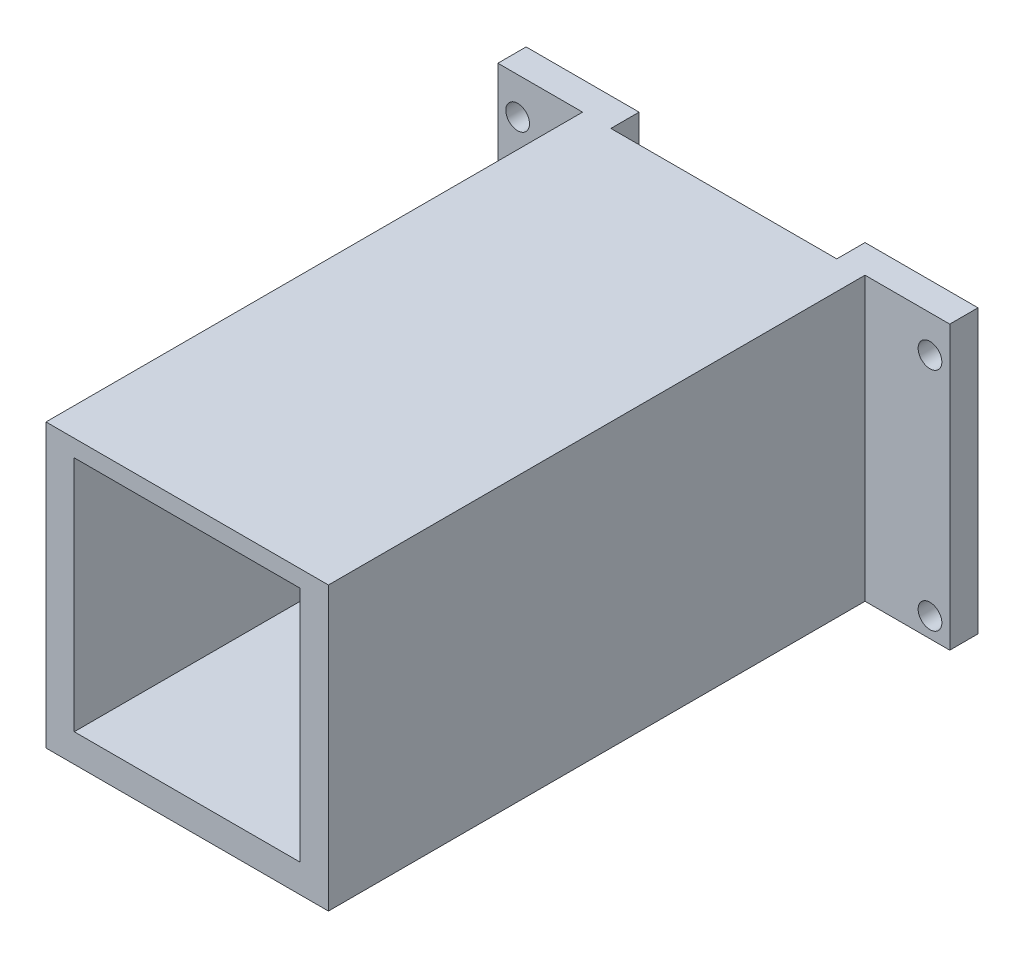
from build123d import *

# Parameters (mm, degrees)
SKETCH_1_W          = 80
SKETCH_1_H          = 50
EXTRUDE_1_DEPTH     = 5
SKETCH_2_W          = 50
SKETCH_2_H          = 50
EXTRUDE_2_DEPTH     = 100
SKETCH_4_W          = 40
SKETCH_4_H          = 42
CUT_EXTRUDE_1_DEPTH = 138.477270849
SKETCH_5_R          = 2.1
CUT_EXTRUDE_2_DEPTH = 10
CUT_EXTRUDE_START   = 40
SKETCH_7_W          = 40
SKETCH_7_H          = 5
CUT_EXTRUDE_4_DEPTH = 98.477270849


with BuildPart() as part:
    # 草圖1 → 填料-伸長1 (new body)
    with BuildSketch(Plane.XY):
        with Locations((40, 25)):
            Rectangle(SKETCH_1_W, SKETCH_1_H)
    extrude(amount=EXTRUDE_1_DEPTH)

    # 草圖2 → 填料-伸長2 (add)
    with BuildSketch(Plane.XY):
        with Locations((40, 25)):
            Rectangle(SKETCH_2_W, SKETCH_2_H)
    extrude(amount=EXTRUDE_2_DEPTH)

    # 草圖4 → 除料-伸長1 (cut, through all)
    with BuildSketch(Plane.XY):
        with Locations((40, 26)):
            Rectangle(SKETCH_4_W, SKETCH_4_H)
    extrude(amount=CUT_EXTRUDE_1_DEPTH, mode=Mode.SUBTRACT)

    # 草圖5 → 除料-伸長2 (cut)
    with BuildSketch(Plane.XY):
        with Locations(Location((76.5, 3.5, 0), (0, 0, 180))):
            Circle(SKETCH_5_R)
        with Locations(Location((76.5, 43.5, 0), (0, 0, 180))):
            Circle(SKETCH_5_R)
        with Locations(Location((3.5, 3.5, 0), (0, 0, 180))):
            Circle(SKETCH_5_R)
        with Locations(Location((3.5, 43.5, 0), (0, 0, 180))):
            Circle(SKETCH_5_R)
    extrude(amount=CUT_EXTRUDE_2_DEPTH, mode=Mode.SUBTRACT)

    # 草圖7 → 除料-伸長4 (cut, through all)
    with BuildSketch(Plane(origin=(0, 0, 0), x_dir=(1, 0, 0), z_dir=(0, 1, 0)).offset(CUT_EXTRUDE_START)):
        with Locations((40, -2.5)):
            Rectangle(SKETCH_7_W, SKETCH_7_H)
    extrude(amount=CUT_EXTRUDE_4_DEPTH, mode=Mode.SUBTRACT)


solid = part.part
